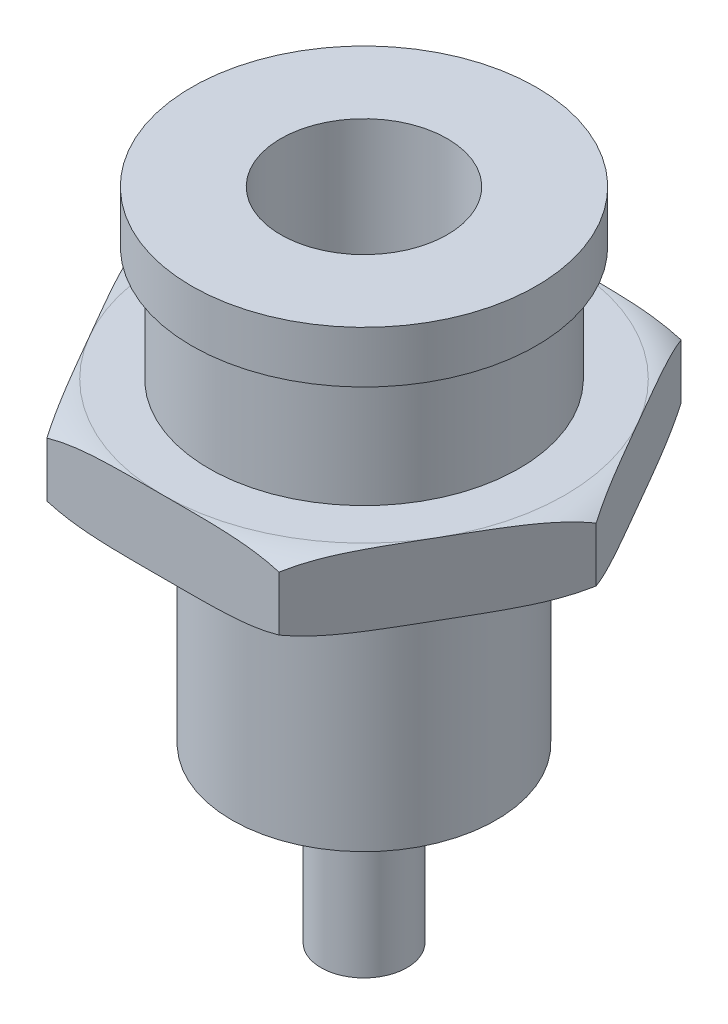
from build123d import *

# Parameters (mm, degrees)
BOSS_EXTRUDE1_START = 4
BOSS_EXTRUDE1_DEPTH = 2.5


with BuildPart() as part:
    # Sketch1 → Revolve1 (revolve)
    with BuildSketch(Plane.XY, mode=Mode.PRIVATE) as revolve1_sk:
        Polygon((0, 0), (0, 12.8), (2.9, 12.8), (2.9, 22.8), (6, 22.8), (6, 21), (5.4, 21), (5.4, 16), (4.6, 16), (4.6, 6), (1.5, 6), (1.5, 0), align=None)
    revolve(revolve1_sk.sketch.rotate(Axis((0, 0, 0), (0, 1, 0)), 90), axis=Axis((0, 0, 0), (0, 1, 0)))

    # Sketch2 → Boss-Extrude1 (add)
    with BuildSketch(Plane.XZ.offset(-21).offset(BOSS_EXTRUDE1_START)):
        Polygon((8.082903769, 0), (4.041451884, 7), (-4.041451884, 7), (-8.082903769, 0), (-4.041451884, -7), (4.041451884, -7), align=None)
    extrude(amount=BOSS_EXTRUDE1_DEPTH)

    # Sketch3 → Cut-Revolve1 (revolve, cut)
    with BuildSketch(Plane.XY):
        with BuildLine():
            Line((-8.082903769, 16.7), (-8.082903769, 17))
            Line((-8.082903769, 17), (-7, 17))
            ThreePointArc((-7, 17), (-7.561845302, 16.923613695), (-8.082903769, 16.7))
        make_face()
        with BuildLine():
            Line((-8.082903769, 14.8), (-8.082903769, 14.5))
            Line((-8.082903769, 14.5), (-7, 14.5))
            ThreePointArc((-7, 14.5), (-7.561845302, 14.576386305), (-8.082903769, 14.8))
        make_face()
    revolve(axis=Axis((0, 14.5, 0), (0, 1, 0)), mode=Mode.SUBTRACT)


solid = part.part
